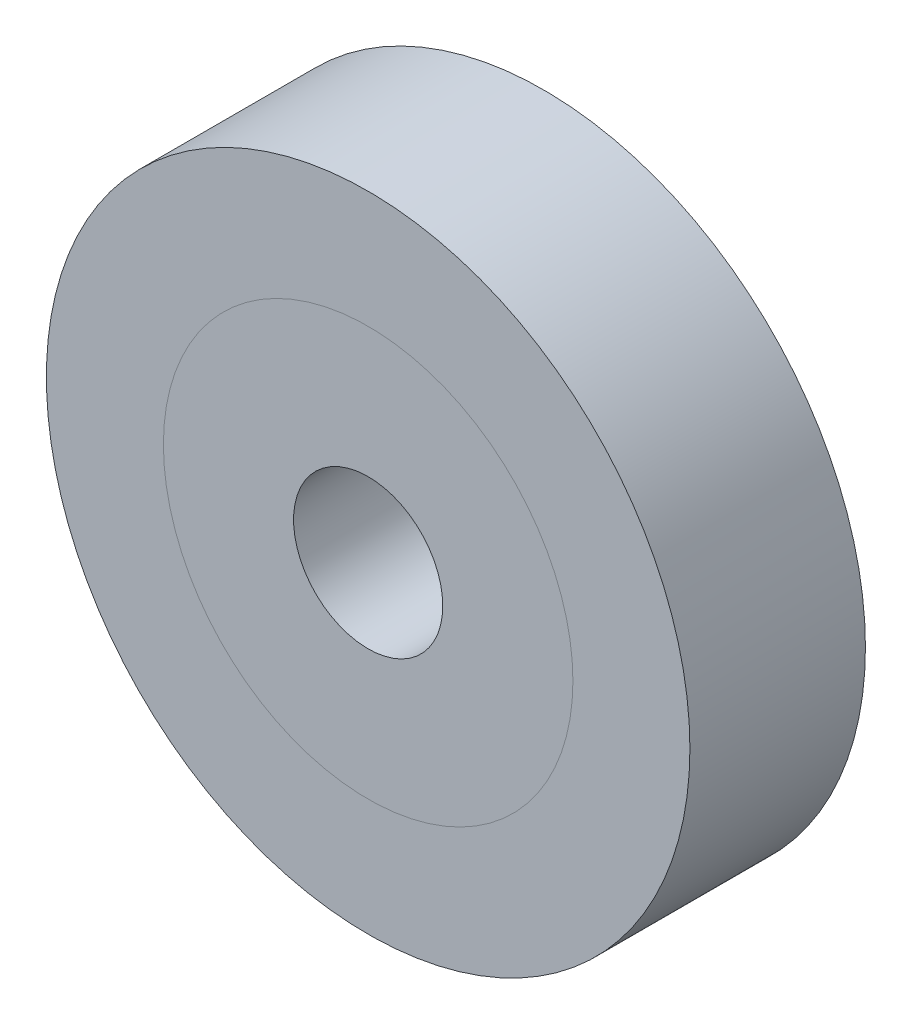
from build123d import *

# Parameters (mm, degrees)
SKETCH_1_R                     = 22
SKETCH_1_R_2                   = 5.1
EXTRUDE_1_DEPTH                = 12
SPLIT_BODIES_1_SURFACE_1_BACK  = 64.372
SPLIT_BODIES_1_SURFACE_1_DEPTH = 128.744
SPLIT_BODIES_1_SURFACE_2_BACK  = 64.372
SPLIT_BODIES_1_SURFACE_2_DEPTH = 128.744


with BuildPart() as part:
    # 草图1 → 凸台-拉伸1 (new body)
    with BuildSketch(Plane.XY):
        Circle(SKETCH_1_R)
        Circle(SKETCH_1_R_2, mode=Mode.SUBTRACT)
    extrude(amount=EXTRUDE_1_DEPTH)


with BuildPart() as body_2:
    # Split Bodies 1: the piece behind the surface
    add(part.part)
    # Split Bodies 1 surface: a surface, the sketch's curves swept straight by 128.744 mm
    with BuildLine(Plane.XY.offset(12).offset(-SPLIT_BODIES_1_SURFACE_1_BACK), mode=Mode.PRIVATE) as split_bodies_1_surface_1_path:
        CenterArc((0, 0), 14, 0, 360)
    split_bodies_1_surface_1 = Shell.extrude(split_bodies_1_surface_1_path.wire(), (0 * SPLIT_BODIES_1_SURFACE_1_DEPTH, 0 * SPLIT_BODIES_1_SURFACE_1_DEPTH, 1 * SPLIT_BODIES_1_SURFACE_1_DEPTH))
    split(bisect_by=split_bodies_1_surface_1, keep=Keep.BOTTOM)


with BuildPart() as part_1:
    add(part.part)

    # Split Bodies 1: split by a surface, the side it looks to stays
    # Split Bodies 1 surface: a surface, the sketch's curves swept straight by 128.744 mm
    with BuildLine(Plane.XY.offset(12).offset(-SPLIT_BODIES_1_SURFACE_2_BACK), mode=Mode.PRIVATE) as split_bodies_1_surface_2_path:
        CenterArc((0, 0), 14, 0, 360)
    split_bodies_1_surface_2 = Shell.extrude(split_bodies_1_surface_2_path.wire(), (0 * SPLIT_BODIES_1_SURFACE_2_DEPTH, 0 * SPLIT_BODIES_1_SURFACE_2_DEPTH, 1 * SPLIT_BODIES_1_SURFACE_2_DEPTH))
    split(bisect_by=split_bodies_1_surface_2, keep=Keep.TOP)


solid = Compound([body_2.part, part_1.part])
